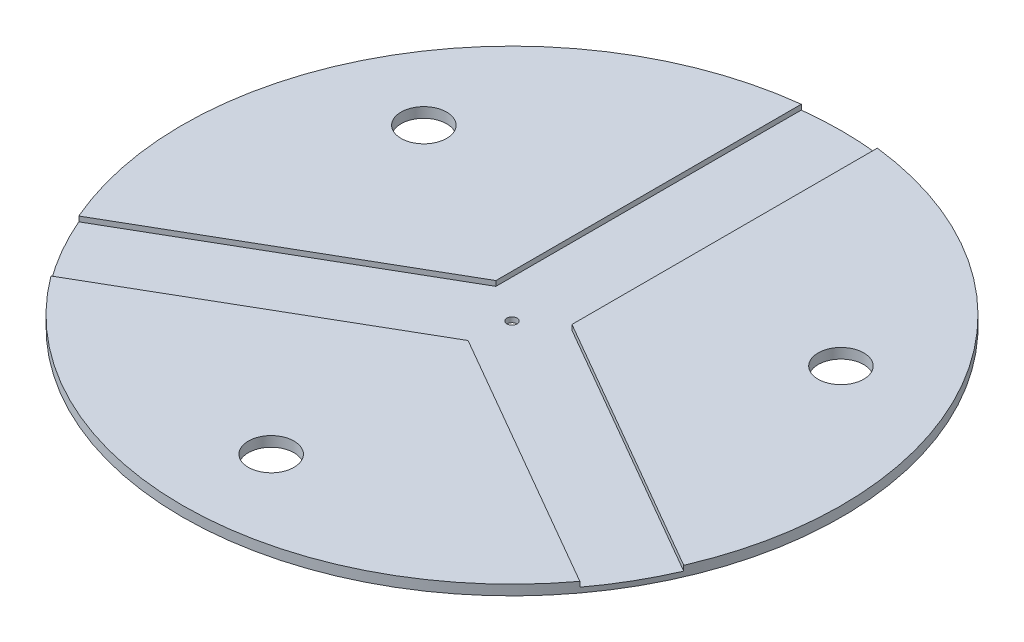
from build123d import *

# Parameters (mm, degrees)
SKETCH1_R               = 65
SKETCH1_R_2             = 1
BOSS_EXTRUDE1_DEPTH     = 1
CUT_EXTRUDE1_DEPTH      = 1
CUT_EXTRUDE2_DEPTH      = 1
CUT_EXTRUDE2_DEPTH_BACK = 92.929320676
SKETCH3_R               = 4.5


with BuildPart() as part:
    # Sketch1 → Boss-Extrude1 (new, symmetric)
    with BuildSketch(Plane(origin=(0, 0, 0), x_dir=(1, 0, 0), z_dir=(0, 1, 0))):
        Circle(SKETCH1_R)
        Circle(SKETCH1_R_2, mode=Mode.SUBTRACT)
    extrude(amount=BOSS_EXTRUDE1_DEPTH, both=True)

    # Sketch2 → Cut-Extrude1 (cut)
    with BuildSketch(Plane(origin=(0, 1, 0), x_dir=(1, 0, 0), z_dir=(0, 1, 0))):
        Polygon((67.534801337, -30.330981694), (7.5, 4.330127019), (7.5, 73.652344444), (-7.5, 73.652344444), (-7.5, 4.330127019), (-67.534801337, -30.330981694), (-60.034801337, -43.32136275), (0, -8.660254038), (60.034801337, -43.32136275), align=None)
    extrude(amount=-CUT_EXTRUDE1_DEPTH, mode=Mode.SUBTRACT)

    # Sketch3 → Cut-Extrude2 (cut, two sides: drawn at the far end of the back side and taken through both)
    with BuildSketch(Plane(origin=(0, 0, 0), x_dir=(1, 0, 0), z_dir=(0, 1, 0)).offset(-CUT_EXTRUDE2_DEPTH_BACK)):
        with Locations((41.13620668, 23.75)):
            Circle(SKETCH3_R)
        with Locations((0, -47.5)):
            Circle(SKETCH3_R)
        with Locations((-41.13620668, 23.75)):
            Circle(SKETCH3_R)
    extrude(amount=CUT_EXTRUDE2_DEPTH + CUT_EXTRUDE2_DEPTH_BACK, mode=Mode.SUBTRACT)


solid = part.part
